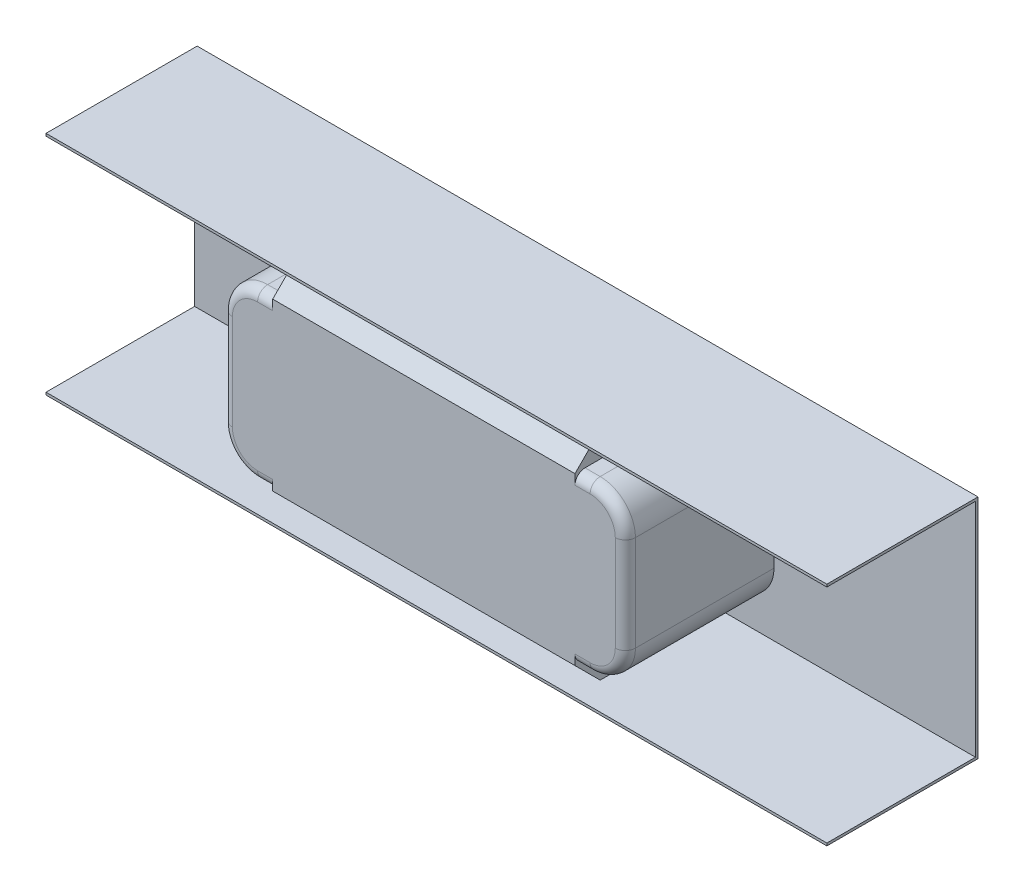
from build123d import *

# Parameters (mm, degrees)
SKETCH1_W               = 150
SKETCH1_H               = 45
EXTRUDE1_DEPTH          = 30
CUT_EXTRUDE1_DEPTH      = 29.5
FILLET1_R               = 2
CHAMFER1_SIZE           = 5
SALIENTE_EXTRUIR1_DEPTH = 5


with BuildPart() as part:
    # Sketch1 → Extrude1 (new body)
    with BuildSketch(Plane.XY):
        with Locations((40.803073286, 1.99929078)):
            Rectangle(SKETCH1_W, SKETCH1_H)
    extrude(amount=EXTRUDE1_DEPTH)

    # Sketch2 → Cut-Extrude1 (cut)
    with BuildSketch(Plane.XY.offset(30)):
        Polygon((-34.196926714, 23.99929078), (-34.196926714, -20.00070922), (-33.696926714, -20.00070922), (10.803073286, -20.00070922), (70.803073286, -20.00070922), (115.303073286, -20.00070922), (115.803073286, -20.00070922), (115.803073286, 23.99929078), (115.303073286, 23.99929078), (70.803073286, 23.99929078), (10.803073286, 23.99929078), (-33.696926714, 23.99929078), align=None)
        with BuildLine():
            Line((70.803073286, -19.50070922), (70.803073286, -14.50070922))
            Line((70.803073286, -14.50070922), (73.803073286, -14.50070922))
            ThreePointArc((73.803073286, -14.50070922), (78.752820754, -12.450456688), (80.803073286, -7.50070922))
            Line((80.803073286, -7.50070922), (80.803073286, 11.49929078))
            ThreePointArc((80.803073286, 11.49929078), (78.752820754, 16.449038248), (73.803073286, 18.49929078))
            Line((73.803073286, 18.49929078), (70.803073286, 18.49929078))
            Line((70.803073286, 18.49929078), (70.803073286, 23.49929078))
            Line((70.803073286, 23.49929078), (10.803073286, 23.49929078))
            Line((10.803073286, 23.49929078), (10.803073286, 18.49929078))
            Line((10.803073286, 18.49929078), (7.803073286, 18.49929078))
            ThreePointArc((7.803073286, 18.49929078), (2.853325818, 16.449038248), (0.803073286, 11.49929078))
            Line((0.803073286, 11.49929078), (0.803073286, -7.50070922))
            ThreePointArc((0.803073286, -7.50070922), (2.853325818, -12.450456688), (7.803073286, -14.50070922))
            Line((7.803073286, -14.50070922), (10.803073286, -14.50070922))
            Line((10.803073286, -14.50070922), (10.803073286, -19.50070922))
            Line((10.803073286, -19.50070922), (70.803073286, -19.50070922))
        make_face(mode=Mode.SUBTRACT)
    extrude(amount=-CUT_EXTRUDE1_DEPTH, mode=Mode.SUBTRACT)

    # Fillet1
    fillet1_edges = [part.edges().sort_by_distance(p)[0] for p in [
        (78.752820754, -12.450456688, 30),
        (80.803073286, 1.99929078, 30),
        (78.752820754, 16.449038248, 30),
        (72.303073286, 18.49929078, 30),
        (9.303073286, 18.49929078, 30),
        (2.853325818, 16.449038248, 30),
        (0.803073286, 1.99929078, 30),
        (2.853325818, -12.450456688, 30),
        (9.303073286, -14.50070922, 30),
        (72.303073286, -14.50070922, 30),
    ]]
    fillet(fillet1_edges, radius=FILLET1_R)

    # Chamfer1
    chamfer1_edges = [part.edges().sort_by_distance(p)[0] for p in [
        (40.803073286, 23.49929078, 30),
        (40.803073286, -19.50070922, 30),
    ]]
    chamfer(chamfer1_edges, length=CHAMFER1_SIZE)

    # Croquis1 → Saliente-Extruir1 (add)
    with BuildSketch(Plane(origin=(115.803073286, 0, 0), x_dir=(0, 0, -1), z_dir=(1, 0, 0))):
        Polygon((-0.5, 23.99929078), (-0.5, -20.00070922), (-30, -20.00070922), (-30, -20.50070922), (0, -20.50070922), (0, 24.49929078), (-30, 24.49929078), (-30, 23.99929078), align=None)
    extrude(amount=SALIENTE_EXTRUIR1_DEPTH)


solid = part.part
